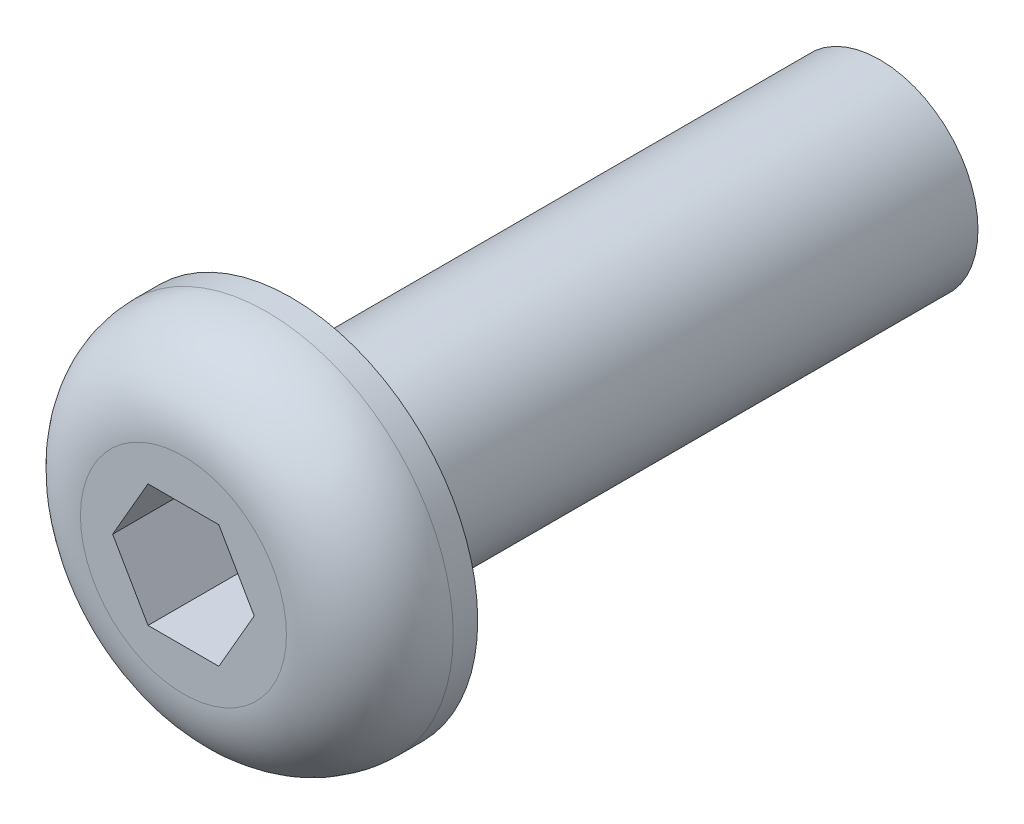
from build123d import *

# Parameters (mm, degrees)
SKETCH1_R          = 2
EXTRUDE1_DEPTH     = 12
CUT_EXTRUDE1_DEPTH = 2


with BuildPart() as part:
    # Sketch1 → Extrude1 (new body)
    with BuildSketch(Plane.XY):
        Circle(SKETCH1_R)
    extrude(amount=-EXTRUDE1_DEPTH)

    # Sketch2 → Revolve1 (revolve)
    with BuildSketch(Plane(origin=(0, 0, 0), x_dir=(0, 0, -1), z_dir=(1, 0, 0)), mode=Mode.PRIVATE) as revolve1_sk:
        with BuildLine():
            Line((0, 0), (0, 3.8))
            Line((0, 3.8), (-0.5, 3.8))
            ThreePointArc((-0.5, 3.8), (-1.702081528, 3.302081528), (-2.2, 2.1))
            Line((-2.2, 2.1), (-2.2, 0))
            Line((-2.2, 0), (0, 0))
        make_face()
    revolve(revolve1_sk.sketch.rotate(Axis((0, 0, 0), (0, 0, 1)), 90), axis=Axis((0, 0, 0), (0, 0, 1)))

    # Sketch3 → Cut-Extrude1 (cut)
    with BuildSketch(Plane.XY.offset(2.2)):
        Polygon((-0.721687836, 1.25), (-1.443375673, 0), (-0.721687836, -1.25), (0.721687836, -1.25), (1.443375673, 0), (0.721687836, 1.25), align=None)
    extrude(amount=-CUT_EXTRUDE1_DEPTH, mode=Mode.SUBTRACT)


solid = part.part
